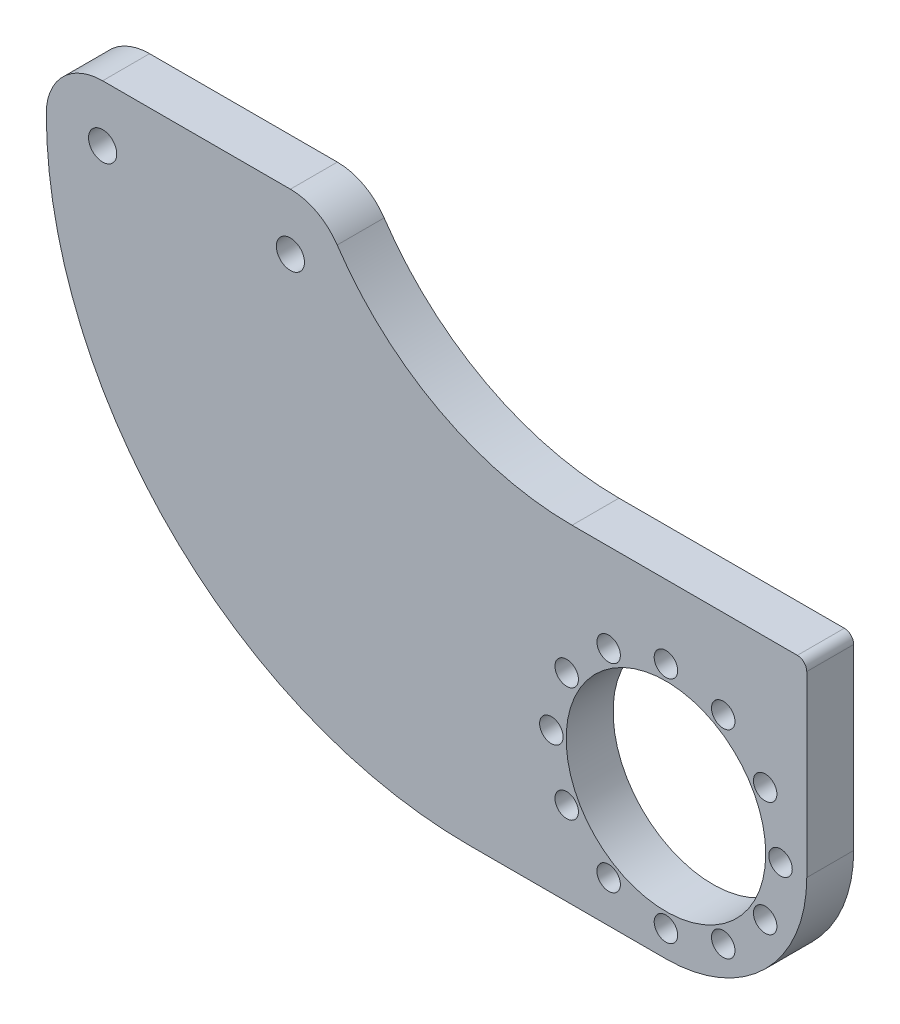
from build123d import *

# Parameters (mm, degrees)
SKETCH1_R           = 1.5875
SKETCH1_R_2         = 13.5001
SKETCH1_R_3         = 1.905
BOSS_EXTRUDE1_DEPTH = 6.35


with BuildPart() as part:
    # Sketch1 → Boss-Extrude1 (new body)
    with BuildSketch(Plane.XY):
        with BuildLine():
            Line((17.78, 25.4), (-12.7, 25.4))
            ThreePointArc((-12.7, 25.4), (-30.704117647, 29.901029412), (-44.471972318, 42.345051903))
            ThreePointArc((-44.471972318, 42.345051903), (-47.214117647, 44.823529412), (-50.8, 45.72))
            Line((-50.8, 45.72), (-76.2, 45.72))
            ThreePointArc((-76.2, 45.72), (-81.588153673, 43.488153673), (-83.82, 38.1))
            ThreePointArc((-83.82, 38.1), (-67.081152545, -2.311152545), (-26.67, -19.05))
            Line((-26.67, -19.05), (0, -19.05))
            ThreePointArc((0, -19.05), (13.470384182, -13.470384182), (19.05, 0))
            Line((19.05, 0), (19.05, 24.13))
            ThreePointArc((19.05, 24.13), (18.678025612, 25.028025612), (17.78, 25.4))
        make_face()
        with Locations((-7.750175, -13.423696868)):
            Circle(SKETCH1_R, mode=Mode.SUBTRACT)
        with Locations((-13.423696868, -7.750175)):
            Circle(SKETCH1_R, mode=Mode.SUBTRACT)
        with Locations((0, -15.50035)):
            Circle(SKETCH1_R, mode=Mode.SUBTRACT)
        with Locations((7.750175, -13.423696868)):
            Circle(SKETCH1_R, mode=Mode.SUBTRACT)
        with Locations((13.423696868, -7.750175)):
            Circle(SKETCH1_R, mode=Mode.SUBTRACT)
        with Locations((-15.50035, 0)):
            Circle(SKETCH1_R, mode=Mode.SUBTRACT)
        with Locations((-13.423696868, 7.750175)):
            Circle(SKETCH1_R, mode=Mode.SUBTRACT)
        Circle(SKETCH1_R_2, mode=Mode.SUBTRACT)
        with Locations((15.50035, 0)):
            Circle(SKETCH1_R, mode=Mode.SUBTRACT)
        with Locations((13.423696868, 7.750175)):
            Circle(SKETCH1_R, mode=Mode.SUBTRACT)
        with Locations((-76.2, 38.1)):
            Circle(SKETCH1_R_3, mode=Mode.SUBTRACT)
        with Locations((-50.8, 38.1)):
            Circle(SKETCH1_R_3, mode=Mode.SUBTRACT)
        with Locations((-7.750175, 13.423696868)):
            Circle(SKETCH1_R, mode=Mode.SUBTRACT)
        with Locations((0, 15.50035)):
            Circle(SKETCH1_R, mode=Mode.SUBTRACT)
        with Locations((7.750175, 13.423696868)):
            Circle(SKETCH1_R, mode=Mode.SUBTRACT)
    extrude(amount=BOSS_EXTRUDE1_DEPTH)


solid = part.part
